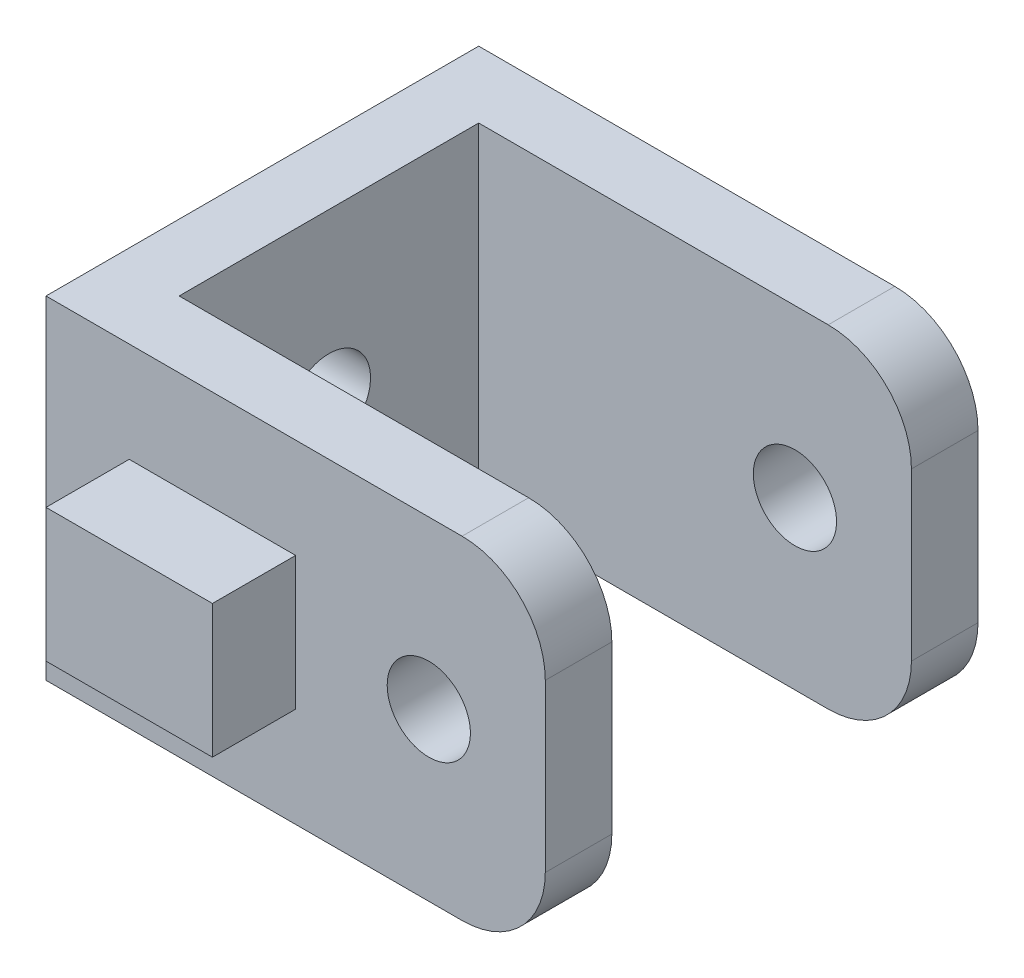
from build123d import *

# Parameters (mm, degrees)
BOSS_EXTRUDE1_DEPTH            = 10
FILLET1_R                      = 5
SKETCH4_W                      = 10
SKETCH4_H                      = 8
BOSS_EXTRUDE2_DEPTH            = 5
CUT_EXTRUDE1_REACH             = 42.939
SKETCH5_R                      = 2.5
CUT_EXTRUDE1_DIRECTION_2_DEPTH = 41.938978981
SKETCH6_W                      = 10
SKETCH6_H                      = 8
BOSS_EXTRUDE3_DEPTH            = 5
SKETCH7_R                      = 2.5
CUT_EXTRUDE2_DEPTH             = 5


with BuildPart() as part:
    # Sketch1 → Boss-Extrude1 (new, symmetric)
    with BuildSketch(Plane(origin=(0, 0, 0), x_dir=(1, 0, 0), z_dir=(0, 1, 0))):
        Polygon((30, -9), (30, -13), (0, -13), (0, 0), (0, 13), (30, 13), (30, 9), (29.572320394, 9), (4, 9), (4, 0), (4, -9), (29.572320394, -9), align=None)
    extrude(amount=BOSS_EXTRUDE1_DEPTH, both=True)

    # Fillet1
    fillet1_edges = [part.edges().sort_by_distance(p)[0] for p in [
        (30, -10, -11),
        (30, -10, 11),
        (30, 10, -11),
        (30, 10, 11),
    ]]
    fillet(fillet1_edges, radius=FILLET1_R)

    # Sketch4 → Boss-Extrude2 (add)
    with BuildSketch(Plane.XY.offset(13)):
        with Locations((10, 0)):
            Rectangle(SKETCH4_W, SKETCH4_H)
    extrude(amount=BOSS_EXTRUDE2_DEPTH)

    # Cut-Extrude1: up to this face of the body (flat: up to its plane)
    cut_extrude1_end = Plane(part.part.faces().sort_by_distance((14.747199742, 0, -13))[0])
    # Sketch5 → Cut-Extrude1 (cut, up to the picked face)
    with BuildSketch(Plane.XY.offset(13), mode=Mode.PRIVATE) as cut_extrude1_sk1:
        with Locations(Location((23, 0, 0), (0, 0, 180))):
            Circle(SKETCH5_R)
    cut_extrude1_tool1 = split(extrude(cut_extrude1_sk1.sketch, amount=-CUT_EXTRUDE1_REACH, mode=Mode.PRIVATE), bisect_by=cut_extrude1_end, keep=Keep.BOTH, mode=Mode.PRIVATE)
    add(cut_extrude1_tool1.solids().sort_by(Axis((23, 0, 13), (0, 0, -1)))[0], mode=Mode.SUBTRACT)

    # Sketch5 → Cut-Extrude1 direction 2 (cut)
    with BuildSketch(Plane.XY.offset(13)):
        with Locations(Location((23, 0, 0), (0, 0, 180))):
            Circle(SKETCH5_R)
    extrude(amount=CUT_EXTRUDE1_DIRECTION_2_DEPTH, mode=Mode.SUBTRACT)

    # Sketch6 → Boss-Extrude3 (add)
    with BuildSketch(Plane(origin=(0, 0, -13), x_dir=(-1, 0, 0), z_dir=(0, 0, -1))):
        with Locations((-10, 0)):
            Rectangle(SKETCH6_W, SKETCH6_H)
    extrude(amount=BOSS_EXTRUDE3_DEPTH)

    # Sketch7 → Cut-Extrude2 (cut)
    with BuildSketch(Plane.ZY):
        Circle(SKETCH7_R)
    extrude(amount=-CUT_EXTRUDE2_DEPTH, mode=Mode.SUBTRACT)


solid = part.part
